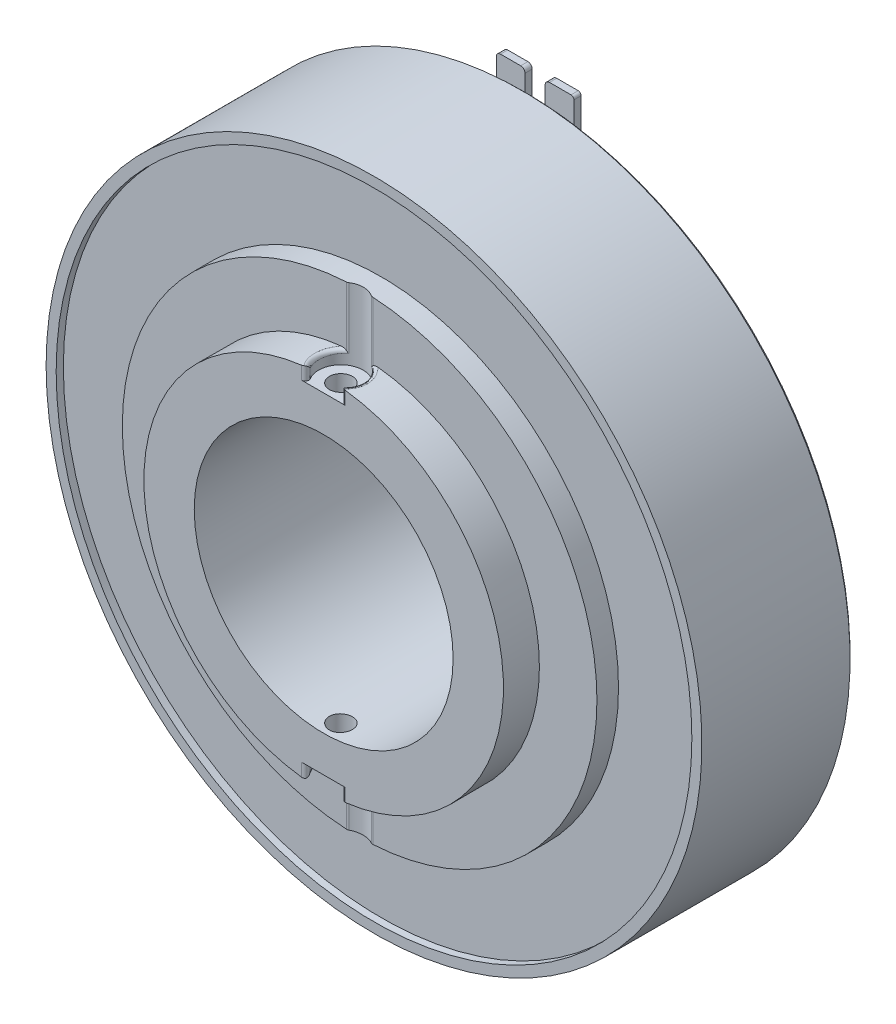
from build123d import *

# Parameters (mm, degrees)
BOSS_EXTRUDE1_START      = -2
SKETCH1_R                = 12.5
SKETCH1_R_2              = 9
BOSS_EXTRUDE1_DEPTH      = 16
BOSS_EXTRUDE2_START      = -2
SKETCH1_3_R              = 16.5
SKETCH1_3_R_2            = 12.5
BOSS_EXTRUDE2_DEPTH      = 13.5
SKETCH1_4_R              = 22.1
SKETCH1_4_R_2            = 16.5
BOSS_EXTRUDE3_DEPTH      = 10
SKETCH1_5_R              = 22.8
SKETCH1_5_R_2            = 22.1
BOSS_EXTRUDE4_DEPTH      = 10.5
CUT_EXTRUDE1_DEPTH       = 36.152240327
CUT_EXTRUDE1_DEPTH_BACK  = 36.152240327
SKETCH2_R                = 0.6
CHAMFER1_SIZE            = 0.3
CHAMFER2_SIZE            = 0.2
BOSS_EXTRUDE6_DEPTH      = 0.5
SKETCH4_R                = 0.7
CUT_EXTRUDE2_DEPTH       = 0.5
CUT_EXTRUDE3_DEPTH       = 36.975789378
CUT_EXTRUDE3_DEPTH_BACK  = 36.975789378
SKETCH5_R                = 0.8
CUT_EXTRUDE4_START       = -1
SKETCH6_R                = 1.55
CUT_EXTRUDE4_DEPTH       = 47.296414596
FILLET1_R                = 0.25
CIRPATTERN1_COUNT        = 2
FILLET1_OF_CIRPATTERN1_R = 0.25


with BuildPart() as part:
    # Sketch1 → Boss-Extrude1 (new body)
    with BuildSketch(Plane.XY.offset(BOSS_EXTRUDE1_START)):
        Circle(SKETCH1_R)
        Circle(SKETCH1_R_2, mode=Mode.SUBTRACT)
    extrude(amount=BOSS_EXTRUDE1_DEPTH)

    # Sketch1<3> → Boss-Extrude2 (add)
    with BuildSketch(Plane.XY.offset(BOSS_EXTRUDE2_START)):
        Circle(SKETCH1_3_R)
        Circle(SKETCH1_3_R_2, mode=Mode.SUBTRACT)
    extrude(amount=BOSS_EXTRUDE2_DEPTH)

    # Sketch1<4> → Boss-Extrude3 (add)
    with BuildSketch(Plane.XY):
        Circle(SKETCH1_4_R)
        Circle(SKETCH1_4_R_2, mode=Mode.SUBTRACT)
    extrude(amount=BOSS_EXTRUDE3_DEPTH)

    # Sketch1<5> → Boss-Extrude4 (add)
    with BuildSketch(Plane.XY):
        with Locations(Location((0, 0, 0), (0, 0, 180))):
            Circle(SKETCH1_5_R)
        with Locations(Location((0, 0, 0), (0, 0, 180))):
            Circle(SKETCH1_5_R_2, mode=Mode.SUBTRACT)
    extrude(amount=BOSS_EXTRUDE4_DEPTH)

    # Sketch2 → Cut-Extrude1 (cut, two sides: drawn at the far end of the back side and taken through both)
    with BuildSketch(Plane(origin=(0, 0, 0), x_dir=(1, 0, 0), z_dir=(0, 1, 0)).offset(-CUT_EXTRUDE1_DEPTH_BACK)):
        with Locations(Location((0, -12.8, 0), (0, 0, 270))):
            Circle(SKETCH2_R)
    extrude(amount=CUT_EXTRUDE1_DEPTH + CUT_EXTRUDE1_DEPTH_BACK, mode=Mode.SUBTRACT)

    # Chamfer1
    chamfer1_edges = [part.edges().sort_by_distance(p)[0] for p in [
        (-9, 0, -2),
    ]]
    chamfer(chamfer1_edges, length=CHAMFER1_SIZE)

    # Chamfer2
    chamfer2_edges = [part.edges().sort_by_distance(p)[0] for p in [
        (22.8, 0, 0),
    ]]
    chamfer(chamfer2_edges, length=CHAMFER2_SIZE)

    # Sketch3 → Boss-Extrude6 (add)
    with BuildSketch(Plane(origin=(0, 0, 0), x_dir=(-1, 0, 0), z_dir=(0, 0, -1))):
        with BuildLine():
            Line((-1.4, 23.750310156), (-1.4, 21.650310156))
            ThreePointArc((-1.4, 21.650310156), (-0.7, 20.950310156), (0, 21.650310156))
            Line((0, 21.650310156), (0, 23.750310156))
            ThreePointArc((0, 23.750310156), (0.087867966, 23.96244219), (0.3, 24.050310156))
            Line((0.3, 24.050310156), (1.7, 24.050310156))
            ThreePointArc((1.7, 24.050310156), (1.912132034, 23.96244219), (2, 23.750310156))
            Line((2, 23.750310156), (2, 20.050310156))
            Line((2, 20.050310156), (2.56362055, 19.845169052))
            ThreePointArc((2.56362055, 19.845169052), (3.040752451, 19.479052867), (3.221600407, 18.905476431))
            Line((3.221600407, 18.905476431), (3.221600407, 18.605683969))
            ThreePointArc((3.221600407, 18.605683969), (2.928707188, 17.898577188), (2.221600407, 17.605683969))
            Line((2.221600407, 17.605683969), (-3.621600407, 17.605683969))
            ThreePointArc((-3.621600407, 17.605683969), (-4.328707188, 17.898577188), (-4.621600407, 18.605683969))
            Line((-4.621600407, 18.605683969), (-4.621600407, 18.905476431))
            ThreePointArc((-4.621600407, 18.905476431), (-4.440752451, 19.479052867), (-3.96362055, 19.845169052))
            Line((-3.96362055, 19.845169052), (-3.4, 20.050310156))
            Line((-3.4, 20.050310156), (-3.4, 23.850310156))
            ThreePointArc((-3.4, 23.850310156), (-3.341421356, 23.991731512), (-3.2, 24.050310156))
            Line((-3.2, 24.050310156), (-1.7, 24.050310156))
            ThreePointArc((-1.7, 24.050310156), (-1.487867966, 23.96244219), (-1.4, 23.750310156))
        make_face()
    boss_extrude6 = extrude(amount=BOSS_EXTRUDE6_DEPTH)

    # Sketch4 → Cut-Extrude2 (cut)
    with BuildSketch(Plane(origin=(0, 0, -0.5), x_dir=(-1, 0, 0), z_dir=(0, 0, -1))):
        with Locations((-2, 19.105683969)):
            Circle(SKETCH4_R)
        with Locations((0.6, 19.105683969)):
            Circle(SKETCH4_R)
    cut_extrude2 = extrude(amount=-CUT_EXTRUDE2_DEPTH, mode=Mode.SUBTRACT)

    # Mirror1: Boss-Extrude6, Cut-Extrude2 across plane
    add(boss_extrude6.mirror(Plane.ZX))
    add(cut_extrude2.mirror(Plane.ZX), mode=Mode.SUBTRACT)

    # Sketch5 → Cut-Extrude3 (cut, two sides: drawn at the far end of the back side and taken through both)
    with BuildSketch(Plane(origin=(0, 0, 0), x_dir=(1, 0, 0), z_dir=(0, 1, 0)).offset(-CUT_EXTRUDE3_DEPTH_BACK)):
        with Locations(Location((0, -12.8, 0), (0, 0, 270))):
            Circle(SKETCH5_R)
    extrude(amount=CUT_EXTRUDE3_DEPTH + CUT_EXTRUDE3_DEPTH_BACK, mode=Mode.SUBTRACT)

    # Sketch6 → Cut-Extrude4 (cut)
    with BuildSketch(Plane(origin=(0, 12.5, 0), x_dir=(1, 0, 0), z_dir=(0, 1, 0)).offset(CUT_EXTRUDE4_START)):
        with Locations((0, -12.8)):
            Circle(SKETCH6_R)
    cut_extrude4 = extrude(amount=CUT_EXTRUDE4_DEPTH, mode=Mode.SUBTRACT)

    # Fillet1
    fillet1_edges = [part.edges().sort_by_distance(p)[0] for p in [
        (1.5476707, 12.403818581, 12.715056311),
        (-1.547670692, 12.403818591, 12.715056307),
        (-0.981070844, 11.980720263, 14),
        (0.981070844, 11.980720263, 14),
        (-0.844097151, 14.474931191, 11.5),
        (0.844097151, 14.474931191, 11.5),
    ]]
    fillet(fillet1_edges, radius=FILLET1_R)

    # CirPattern1: Cut-Extrude4 ×2 about axis
    cirpattern1_axis = Axis((0, 0, 14), (0, 0, -1))
    for i in range(1, CIRPATTERN1_COUNT):
        add(cut_extrude4.rotate(cirpattern1_axis, i * 360 / CIRPATTERN1_COUNT), mode=Mode.SUBTRACT)

    # Fillet1 of CirPattern1
    fillet1_of_cirpattern1_edges = [part.edges().sort_by_distance(p)[0] for p in [
        (-1.5476707, -12.403818581, 12.715056311),
        (1.547670692, -12.403818591, 12.715056307),
        (0.981070844, -11.980720263, 14),
        (-0.981070844, -11.980720263, 14),
        (0.844097151, -14.474931191, 11.5),
        (-0.844097151, -14.474931191, 11.5),
    ]]
    fillet(fillet1_of_cirpattern1_edges, radius=FILLET1_OF_CIRPATTERN1_R)


solid = part.part
